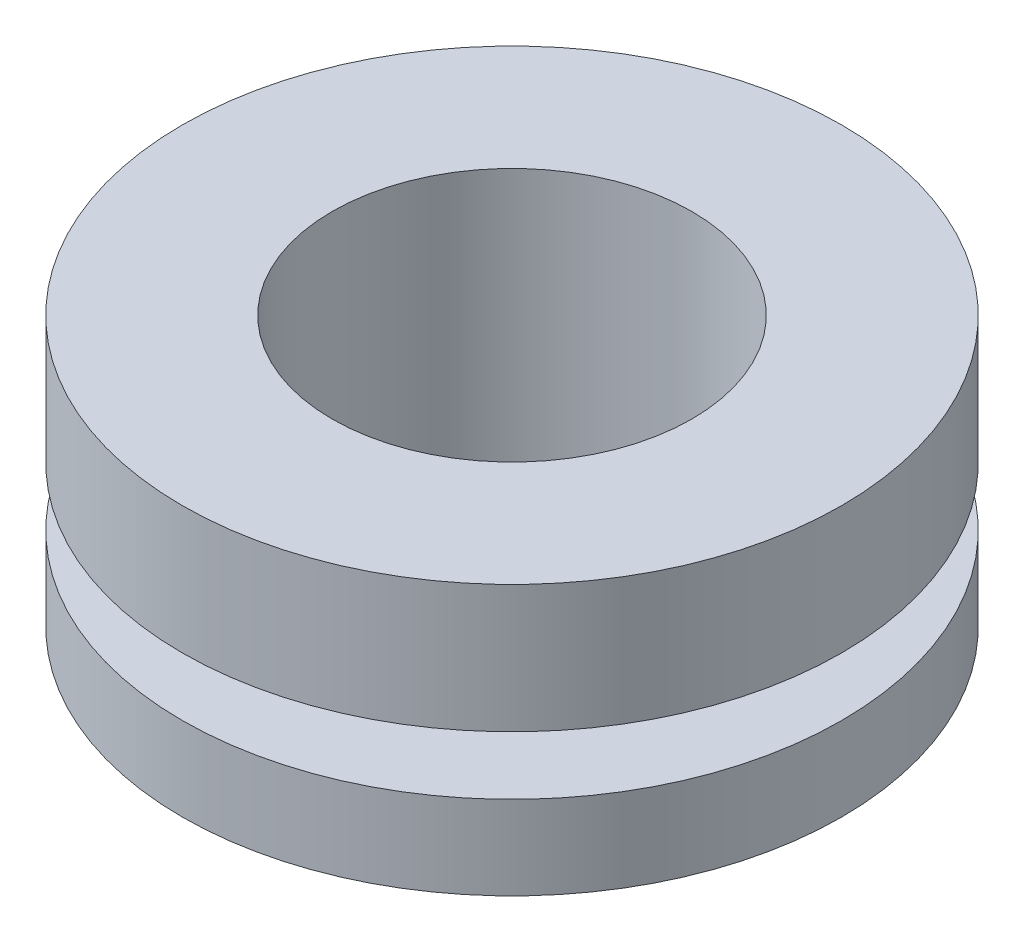
from build123d import *

# Parameters (mm, degrees)
SKETCH_1_R      = 5.5
SKETCH_1_R_2    = 3
EXTRUDE_1_DEPTH = 4.5
SKETCH_2_W      = 1.693229727
SKETCH_2_H      = 0.975939513


with BuildPart() as part:
    # 草图1 → 凸台-拉伸1 (new body)
    with BuildSketch(Plane(origin=(0, 0, 0), x_dir=(1, 0, 0), z_dir=(0, 1, 0))):
        with Locations(Location((0, 0, 0), (0, 0, 270))):
            Circle(SKETCH_1_R)
        with Locations(Location((0, 0, 0), (0, 0, 270))):
            Circle(SKETCH_1_R_2, mode=Mode.SUBTRACT)
    extrude(amount=EXTRUDE_1_DEPTH)

    # 草图2 → 切除-旋转1 (revolve, cut)
    with BuildSketch(Plane.XY, mode=Mode.PRIVATE) as cut_revolve_1_sk:
        with Locations((-4.653385136, 1.883358194)):
            Rectangle(SKETCH_2_W, SKETCH_2_H)
    revolve(cut_revolve_1_sk.sketch.rotate(Axis((0, 4.5, 0), (0, -1, 0)), 270), axis=Axis((0, 4.5, 0), (0, -1, 0)), mode=Mode.SUBTRACT)


solid = part.part
